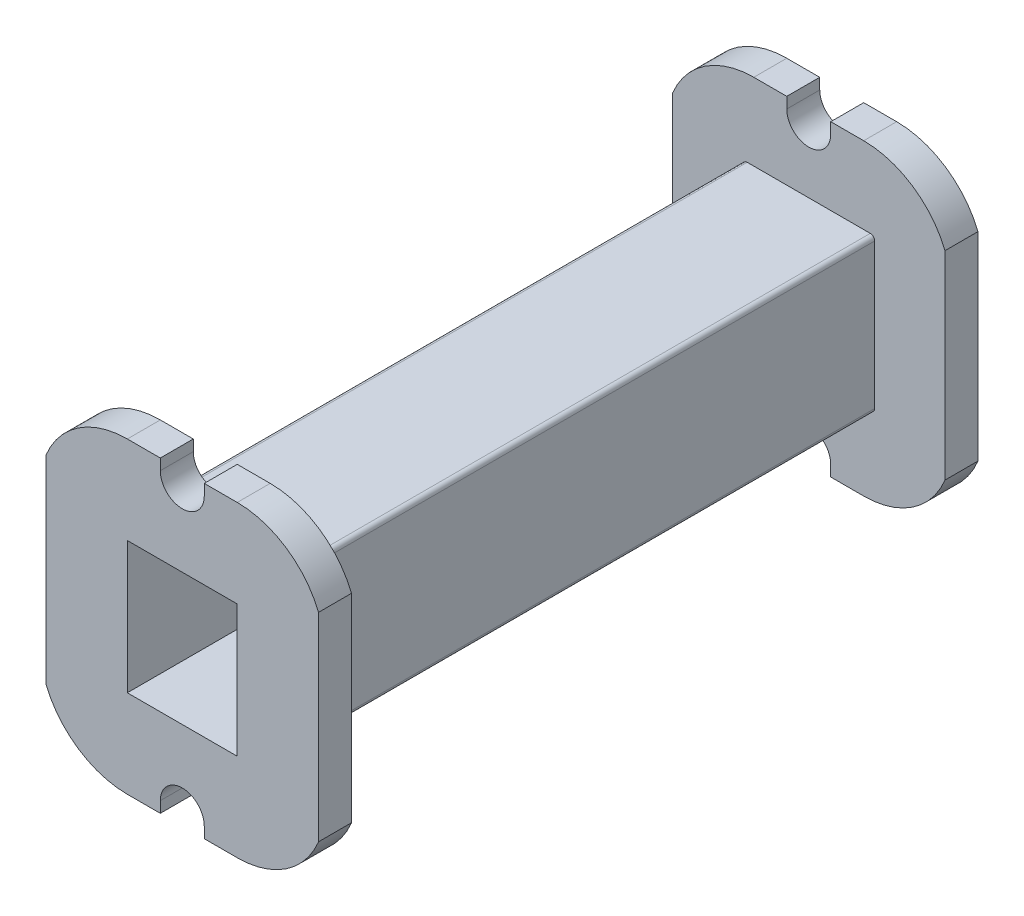
from build123d import *

# Parameters (mm, degrees)
SKETCH_1_W               = 6
SKETCH_1_H               = 7
SKETCH_1_W_2             = 5
SKETCH_1_H_2             = 6
EXTRUDE_1_DEPTH          = 15
SKETCH_2_W               = 6
SKETCH_2_H               = 7
EXTRUDE_2_DEPTH          = 1.5
SKETCH_3_R               = 19.100398606
SKETCH_3_W               = 18.715870292
SKETCH_3_H               = 14
CUT_EXTRUDE_1_DEPTH      = 33.132538026
CUT_EXTRUDE_2_DEPTH      = 32.484122983
CUT_EXTRUDE_3_DEPTH      = 32.484122983
CUT_EXTRUDE_3_DEPTH_BACK = 32.484122983
FILLET_1_R               = 0.2


with BuildPart() as part:
    # 草图1 → 凸台-拉伸1 (new, symmetric)
    with BuildSketch(Plane.XY):
        Rectangle(SKETCH_1_W, SKETCH_1_H)
        Rectangle(SKETCH_1_W_2, SKETCH_1_H_2, mode=Mode.SUBTRACT)
    extrude(amount=EXTRUDE_1_DEPTH, both=True)

    # 草图2 → 凸台-拉伸2 (add)
    with BuildSketch(Plane.XY.offset(15)):
        with BuildLine():
            Line((-6.5, 6.92820323), (-6.5, -6.92820323))
            ThreePointArc((-6.5, -6.92820323), (0, -9.5), (6.5, -6.92820323))
            Line((6.5, -6.92820323), (6.5, 6.92820323))
            ThreePointArc((6.5, 6.92820323), (0, 9.5), (-6.5, 6.92820323))
        make_face()
        Rectangle(SKETCH_2_W, SKETCH_2_H, mode=Mode.SUBTRACT)
    extrude_2 = extrude(amount=-EXTRUDE_2_DEPTH)

    # 镜向1: 凸台-拉伸2 across plane
    add(extrude_2.mirror(Plane.XY))

    # 草图3 → 切除-拉伸1 (cut, through all)
    with BuildSketch(Plane.XY.offset(15)):
        Circle(SKETCH_3_R)
        Rectangle(SKETCH_3_W, SKETCH_3_H, mode=Mode.SUBTRACT)
    extrude(amount=-CUT_EXTRUDE_1_DEPTH, mode=Mode.SUBTRACT)

    # 草图4 → 切除-拉伸2 (cut, through all)
    with BuildSketch(Plane.XY.offset(15)):
        with BuildLine():
            Line((-6.5, 6.92820323), (-6.5, 3))
            ThreePointArc((-6.5, 3), (-5.328427125, 5.828427125), (-2.5, 7))
            Line((-2.5, 7), (-6.422616289, 7))
            ThreePointArc((-6.422616289, 7), (-6.461407868, 6.964209098), (-6.5, 6.92820323))
        make_face()
        with BuildLine():
            ThreePointArc((2.5, 7), (5.328427125, 5.828427125), (6.5, 3))
            Line((6.5, 3), (6.5, 6.92820323))
            ThreePointArc((6.5, 6.92820323), (6.461407868, 6.964209098), (6.422616289, 7))
            Line((6.422616289, 7), (2.5, 7))
        make_face()
        with BuildLine():
            ThreePointArc((6.5, -3), (5.328427127, -5.828427123), (2.500000005, -7))
            Line((2.500000005, -7), (6.422616289, -7))
            ThreePointArc((6.422616289, -7), (6.461407868, -6.964209098), (6.5, -6.92820323))
            Line((6.5, -6.92820323), (6.5, -3))
        make_face()
        with BuildLine():
            ThreePointArc((-6.5, -6.92820323), (-6.461407868, -6.964209098), (-6.422616289, -7))
            Line((-6.422616289, -7), (-2.499999995, -7))
            ThreePointArc((-2.499999995, -7), (-5.328427123, -5.828427127), (-6.5, -3))
            Line((-6.5, -3), (-6.5, -6.92820323))
        make_face()
    extrude(amount=-CUT_EXTRUDE_2_DEPTH, mode=Mode.SUBTRACT)

    # 草图5 → 切除-拉伸3 (cut, two sides: drawn at the far end of the back side and taken through both)
    with BuildSketch(Plane.XY.offset(15).offset(-CUT_EXTRUDE_3_DEPTH_BACK)):
        with BuildLine():
            Line((1, 7), (-1, 7))
            Line((-1, 7), (-1, 6.5))
            ThreePointArc((-1, 6.5), (0, 5.5), (1, 6.5))
            Line((1, 6.5), (1, 7))
        make_face()
        with BuildLine():
            Line((-1, -6.5), (-1, -7))
            Line((-1, -7), (1, -7))
            Line((1, -7), (1, -6.5))
            ThreePointArc((1, -6.5), (0, -5.5), (-1, -6.5))
        make_face()
        with BuildLine():
            Line((-6.2, -4.519868415), (-6.2, 4.519868415))
            ThreePointArc((-6.2, 4.519868415), (-6.424283374, 3.774596669), (-6.5, 3))
            Line((-6.5, 3), (-6.5, -3))
            ThreePointArc((-6.5, -3), (-6.424283374, -3.774596669), (-6.2, -4.519868415))
        make_face()
        with BuildLine():
            ThreePointArc((6.5, 3), (6.424283374, 3.774596669), (6.2, 4.519868415))
            Line((6.2, 4.519868415), (6.2, -4.519868415))
            ThreePointArc((6.2, -4.519868415), (6.424283374, -3.774596669), (6.5, -3))
            Line((6.5, -3), (6.5, 3))
        make_face()
    extrude(amount=CUT_EXTRUDE_3_DEPTH + CUT_EXTRUDE_3_DEPTH_BACK, mode=Mode.SUBTRACT)

    # 圆角1
    fillet_1_edges = [part.edges().sort_by_distance(p)[0] for p in [
        (-3, 3.5, 0),
        (3, 3.5, 0),
        (3, -3.5, 0),
        (-3, -3.5, 0),
    ]]
    fillet(fillet_1_edges, radius=FILLET_1_R)


solid = part.part
